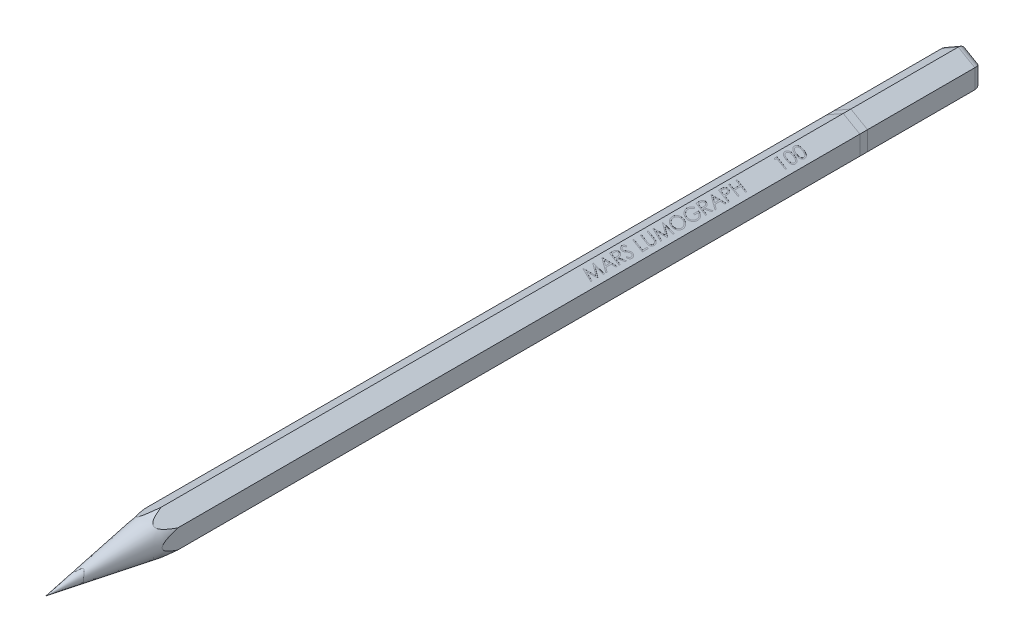
from build123d import *

# Parameters (mm, degrees)
SKETCH2_OUTSIDE_W  = 60.084
SKETCH2_OUTSIDE_H  = 60.084
CUT_EXTRUDE1_DEPTH = 241.104144071
FILLET3_R          = 2
CUT_EXTRUDE2_DEPTH = 0.02


with BuildPart() as part:
    # Sketch1 → Revolve1 (revolve)
    with BuildSketch(Plane(origin=(0, 0, 0), x_dir=(0, 0, -1), z_dir=(1, 0, 0)), mode=Mode.PRIVATE) as revolve1_sk:
        Polygon((0, 0), (240, 0), (240, 5), (30, 5), align=None)
    revolve(revolve1_sk.sketch.rotate(Axis((0, 0, 0), (0, 0, -1)), 270), axis=Axis((0, 0, 0), (0, 0, -1)))

    # Sketch2 outside → Cut-Extrude1 (cut, through all)
    with BuildSketch(Plane(origin=(0, 0, -240), x_dir=(-1, 0, 0), z_dir=(0, 0, -1))):
        Rectangle(SKETCH2_OUTSIDE_W, SKETCH2_OUTSIDE_H)
        Polygon((0, -5), (4.330127019, -2.5), (4.330127019, 2.5), (0, 5), (-4.330127019, 2.5), (-4.330127019, -2.5), align=None, mode=Mode.SUBTRACT)
    extrude(amount=-CUT_EXTRUDE1_DEPTH, mode=Mode.SUBTRACT)

    # Fillet3
    fillet3_edges = [part.edges().sort_by_distance(p)[0] for p in [
        (2.165063509, -3.75, -240),
        (4.330127019, 0, -240),
        (2.165063509, 3.75, -240),
        (-2.165063509, 3.75, -240),
        (-4.330127019, 0, -240),
        (-2.165063509, -3.75, -240),
    ]]
    fillet(fillet3_edges, radius=FILLET3_R)

    # Sketch9 → Cut-Extrude2 (cut)
    # profile 1 of 16: a face of its own
    with BuildSketch(Plane(origin=(2.165063509, 3.75, 0), x_dir=(0.8660254037844346, -0.5000000000000071, 0), z_dir=(0.500000000000007, 0.8660254037844345, 0))):
        Polygon((1.214386361, 138.929143212), (-1.696030305, 139.366988348), (-1.696030305, 139.439865368), (0.692003883, 140.701512336), (-1.696030305, 141.961410256), (-1.696030305, 142.034870292), (1.214386361, 142.47388146), (1.214386361, 142.173628138), (-0.875143553, 141.858216396), (1.214386361, 140.756315855), (1.214386361, 140.649040882), (-0.875143553, 139.544808276), (1.214386361, 139.230562567), align=None)
    # profile 2 of 16: a face of its own
    with BuildSketch(Plane(origin=(2.165063509, 3.75, 0), x_dir=(0.8660254037844346, -0.5000000000000071, 0), z_dir=(0.500000000000007, 0.8660254037844345, 0))):
        Polygon((-1.696030305, 144.376846204), (1.214386361, 145.832054537), (1.214386361, 145.503233423), (0.281560507, 145.036820496), (0.281560507, 143.655072199), (1.214386361, 143.176998948), (1.214386361, 142.847011802), (-1.696030305, 144.33953317), align=None)
        Polygon((-1.082697306, 144.35469159), (-0.016943767, 143.808405448), (-0.016943767, 144.888151375), align=None, mode=Mode.SUBTRACT)
    # profile 3 of 16: a face of its own
    with BuildSketch(Plane(origin=(2.165063509, 3.75, 0), x_dir=(0.8660254037844346, -0.5000000000000071, 0), z_dir=(0.500000000000007, 0.8660254037844345, 0))):
        with BuildLine():
            Line((-1.696030305, 146.317123981), (-1.696030305, 146.946781433))
            add(Edge.make_bspline(
                [(-1.696030305, 146.946781433), (-1.695901844, 146.988952695), (-1.695655565, 147.069801125), (-1.694261827, 147.185653181), (-1.690305739, 147.290770305), (-1.686880658, 147.38528483), (-1.680621428, 147.469205723), (-1.674780718, 147.542580076), (-1.666826998, 147.6052459), (-1.659655048, 147.643123862), (-1.656385207, 147.660393212)],
                knots=[0, 0, 0, 0, 1.414339765, 2.711494627, 3.88531881, 4.942159382, 5.882957806, 6.707302181, 7.410632199, 8, 8, 8, 8], degree=3))
            add(Edge.make_bspline(
                [(-1.656385207, 147.660393212), (-1.651140317, 147.683431605), (-1.640804111, 147.728833811), (-1.618718694, 147.794332332), (-1.593239695, 147.856761319), (-1.563556401, 147.916047869), (-1.528774726, 147.971532298), (-1.49041776, 148.024148704), (-1.447648913, 148.073237713), (-1.401028963, 148.118883534), (-1.350578562, 148.159895922), (-1.297410497, 148.196451202), (-1.241005781, 148.227111288), (-1.181548496, 148.251168857), (-1.119623086, 148.270822147), (-1.054839228, 148.28475711), (-0.987097984, 148.292931837), (-0.941046501, 148.294115044), (-0.917703733, 148.294714793)],
                knots=[0, 0, 0, 0, 1.06985947, 2.108392712, 3.127029127, 4.123234595, 5.107855884, 6.090506905, 7.070353336, 8.054108193, 9.042815066, 10.012321919, 10.973598003, 11.94482246, 12.913889438, 13.913784352, 14.942530328, 16, 16, 16, 16], degree=3))
            add(Edge.make_bspline(
                [(-0.917703733, 148.294714793), (-0.898060806, 148.29442911), (-0.859267882, 148.293864913), (-0.801969186, 148.287866294), (-0.746649136, 148.278006293), (-0.693166751, 148.26429931), (-0.641140171, 148.247961975), (-0.591453682, 148.225686398), (-0.543131198, 148.200969865), (-0.481379876, 148.162650396), (-0.410139212, 148.10536522), (-0.335094303, 148.023258318), (-0.2719311, 147.927494473), (-0.228796509, 147.837997746), (-0.200802775, 147.758908611), (-0.181275241, 147.693661981), (-0.165995795, 147.622605373), (-0.152475229, 147.546408149), (-0.142141193, 147.464678954), (-0.134640214, 147.377548908), (-0.129950121, 147.284981567), (-0.12924496, 147.221387678), (-0.12888287, 147.188733139)],
                knots=[0, 0, 0, 0, 0.765727938, 1.51224032, 2.243597852, 2.954892557, 3.664246923, 4.366767899, 5.075150103, 5.77963024, 7.197468406, 8.624290223, 10.099748923, 11.655498899, 12.484879315, 13.369704222, 14.309208053, 15.317126835, 16.386797013, 17.520226779, 18.72667245, 20, 20, 20, 20], degree=3))
            Line((-0.12888287, 147.188733139), (1.214386361, 148.332027828))
            Line((1.214386361, 148.332027828), (1.214386361, 147.952484308))
            Line((1.214386361, 147.952484308), (-0.12888287, 146.80918962))
            Line((-0.12888287, 146.80918962), (-0.12888287, 146.615628255))
            Line((-0.12888287, 146.615628255), (1.214386361, 146.615628255))
            Line((1.214386361, 146.615628255), (1.214386361, 146.317123981))
            Line((1.214386361, 146.317123981), (-1.696030305, 146.317123981))
        make_face()
        with BuildLine():
            Line((-1.397526032, 146.615628255), (-0.427387143, 146.615628255))
            Line((-0.427387143, 146.615628255), (-0.42330603, 147.178821865))
            add(Edge.make_bspline(
                [(-0.42330603, 147.178821865), (-0.423294438, 147.205256226), (-0.423272012, 147.25639407), (-0.426581587, 147.330243589), (-0.43039036, 147.398891445), (-0.436122229, 147.462103042), (-0.44363141, 147.52007707), (-0.452867249, 147.572627732), (-0.463779139, 147.619987588), (-0.480610385, 147.675046333), (-0.506155164, 147.737239236), (-0.545886943, 147.803453163), (-0.593874413, 147.86134119), (-0.649784955, 147.909213402), (-0.711076352, 147.948314104), (-0.777072105, 147.97548024), (-0.846377584, 147.993699134), (-0.89407124, 147.995364807), (-0.918286749, 147.99621052)],
                knots=[0, 0, 0, 0, 1.174572278, 2.272235562, 3.284492715, 4.22980572, 5.092142038, 5.881598737, 6.600128721, 7.25032431, 8.438816014, 9.577796666, 10.669190652, 11.765187898, 12.836266602, 13.885251582, 14.926278371, 16, 16, 16, 16], degree=3))
            add(Edge.make_bspline(
                [(-0.918286749, 147.99621052), (-0.941694854, 147.99500663), (-0.988111329, 147.992619408), (-1.056133998, 147.975967322), (-1.120512803, 147.947248794), (-1.180581044, 147.90838557), (-1.235021185, 147.860604682), (-1.281253316, 147.804674663), (-1.319501986, 147.742081455), (-1.344794432, 147.684363971), (-1.359921905, 147.632351409), (-1.370481145, 147.587265354), (-1.378241388, 147.535944936), (-1.385221464, 147.478786264), (-1.391034287, 147.415606999), (-1.395024069, 147.346386302), (-1.397350255, 147.271343596), (-1.397466009, 147.21924606), (-1.397526032, 147.192231236)],
                knots=[0, 0, 0, 0, 1.061764534, 2.10539748, 3.155565728, 4.24640529, 5.339665462, 6.429114306, 7.525499099, 8.658981933, 9.275511958, 9.981350656, 10.758339786, 11.628906331, 12.594047291, 13.636338423, 14.774339325, 16, 16, 16, 16], degree=3))
            Line((-1.397526032, 147.192231236), (-1.397526032, 146.615628255))
        make_face(mode=Mode.SUBTRACT)
    # profile 4 of 16: a face of its own
    with BuildSketch(Plane(origin=(2.165063509, 3.75, 0), x_dir=(0.8660254037844346, -0.5000000000000071, 0), z_dir=(0.500000000000007, 0.8660254037844345, 0))):
        with BuildLine():
            Line((0.6529418, 148.667845135), (0.505438712, 148.93428352))
            add(Edge.make_bspline(
                [(0.505438712, 148.93428352), (0.543822105, 148.958054173), (0.617658503, 149.003780704), (0.716320644, 149.081173932), (0.800536571, 149.160430892), (0.870029253, 149.242506906), (0.92367384, 149.328140466), (0.962256279, 149.416653767), (0.986192829, 149.50827017), (0.989067632, 149.570602925), (0.990508156, 149.601837022)],
                knots=[0, 0, 0, 0, 1.253021552, 2.410380904, 3.475470111, 4.460185, 5.388689421, 6.270994921, 7.133619014, 8, 8, 8, 8], degree=3))
            add(Edge.make_bspline(
                [(0.990508156, 149.601837022), (0.989775885, 149.628511937), (0.988324001, 149.68140063), (0.975124643, 149.759310909), (0.953290003, 149.834485222), (0.923817242, 149.906264772), (0.887485456, 149.972895862), (0.845179126, 150.032628121), (0.795397857, 150.08250806), (0.741189983, 150.123960324), (0.683351174, 150.156909139), (0.623012942, 150.180213569), (0.560764399, 150.195092367), (0.518541938, 150.196812957), (0.497276485, 150.197679537)],
                knots=[0, 0, 0, 0, 1.117701984, 2.216081951, 3.301695279, 4.394136047, 5.462520971, 6.477892584, 7.451577853, 8.404902923, 9.331639019, 10.231922614, 11.109503192, 12, 12, 12, 12], degree=3))
            add(Edge.make_bspline(
                [(0.497276485, 150.197679537), (0.473035941, 150.196265572), (0.423912065, 150.193400147), (0.35111816, 150.171613629), (0.278929925, 150.136927067), (0.234629034, 150.104399444), (0.211598567, 150.087489483)],
                knots=[0, 0, 0, 0, 0.931938035, 1.888588254, 2.90235174, 4, 4, 4, 4], degree=3))
            add(Edge.make_bspline(
                [(0.211598567, 150.087489483), (0.194903713, 150.073697157), (0.159764514, 150.044667178), (0.107963932, 149.994620187), (0.053734175, 149.936789213), (-0.002527151, 149.870605461), (-0.062009801, 149.797271444), (-0.123847773, 149.716012161), (-0.188008725, 149.626780479), (-0.230492212, 149.563860422), (-0.252482295, 149.531292067)],
                knots=[0, 0, 0, 0, 0.714777265, 1.504457584, 2.376024072, 3.331596319, 4.371791934, 5.493442797, 6.702568795, 8, 8, 8, 8], degree=3))
            add(Edge.make_bspline(
                [(-0.252482295, 149.531292067), (-0.274271987, 149.498913135), (-0.315903318, 149.437050029), (-0.378066345, 149.350501988), (-0.434183002, 149.272674221), (-0.486453996, 149.204921053), (-0.533034146, 149.146217449), (-0.575257309, 149.097233165), (-0.612776805, 149.058020463), (-0.63734513, 149.036182273), (-0.648350267, 149.026400073)],
                knots=[0, 0, 0, 0, 1.456563732, 2.782907058, 3.976925193, 5.037437426, 5.976523114, 6.773507667, 7.450604967, 8, 8, 8, 8], degree=3))
            add(Edge.make_bspline(
                [(-0.648350267, 149.026400073), (-0.665450136, 149.012726312), (-0.698974492, 148.985918853), (-0.751812937, 148.950840166), (-0.8054099, 148.920710373), (-0.860724359, 148.897011908), (-0.916653934, 148.877333435), (-0.97411622, 148.863921313), (-1.032551473, 148.856396304), (-1.071793911, 148.855072922), (-1.091442548, 148.854410306)],
                knots=[0, 0, 0, 0, 1.081965651, 2.121197695, 3.131834961, 4.117128275, 5.092440341, 6.059578725, 7.028433586, 8, 8, 8, 8], degree=3))
            add(Edge.make_bspline(
                [(-1.091442548, 148.854410306), (-1.122242101, 148.855662153), (-1.183247989, 148.858141736), (-1.272444894, 148.877360854), (-1.357399158, 148.908604818), (-1.437471141, 148.951776249), (-1.511144579, 149.006954171), (-1.577224538, 149.072520545), (-1.635045214, 149.148246514), (-1.683486071, 149.233061676), (-1.72237699, 149.324872571), (-1.750528721, 149.421494814), (-1.767123105, 149.522170211), (-1.769467496, 149.590504334), (-1.770656374, 149.625157669)],
                knots=[0, 0, 0, 0, 0.967796381, 1.916952393, 2.854571153, 3.806025677, 4.766599812, 5.738784442, 6.723845998, 7.753098465, 8.801775384, 9.851804426, 10.910615437, 12, 12, 12, 12], degree=3))
            add(Edge.make_bspline(
                [(-1.770656374, 149.625157669), (-1.769650858, 149.661970994), (-1.767653121, 149.735110893), (-1.748153848, 149.842479028), (-1.717721772, 149.946383841), (-1.681990642, 150.029874393), (-1.646751243, 150.095684854), (-1.61413621, 150.145466879), (-1.576651869, 150.196007048), (-1.534953227, 150.248011326), (-1.487350424, 150.299897292), (-1.434615175, 150.352377442), (-1.377112899, 150.405924071), (-1.336243779, 150.440942847), (-1.315320753, 150.458870776)],
                knots=[0, 0, 0, 0, 1.343581969, 2.669398873, 3.972209689, 5.29212177, 5.978229007, 6.696944897, 7.463666474, 8.276335723, 9.130634109, 10.034185422, 10.993597435, 12, 12, 12, 12], degree=3))
            Line((-1.315320753, 150.458870776), (-1.136334793, 150.203509699))
            add(Edge.make_bspline(
                [(-1.136334793, 150.203509699), (-1.152725097, 150.188422589), (-1.184484751, 150.159188146), (-1.229428703, 150.115664476), (-1.269637094, 150.073450647), (-1.306208206, 150.033499088), (-1.337257368, 149.994258065), (-1.365334832, 149.95769303), (-1.387742397, 149.922065233), (-1.41298146, 149.8778452), (-1.436696525, 149.821487543), (-1.457335704, 149.751506271), (-1.469840079, 149.678464532), (-1.471376548, 149.628703563), (-1.4721521, 149.603586071)],
                knots=[0, 0, 0, 0, 1.1264946, 2.182819734, 3.162837221, 4.074442579, 4.920099024, 5.692522356, 6.404030606, 7.046419284, 8.265828538, 9.484802126, 10.730421381, 12, 12, 12, 12], degree=3))
            add(Edge.make_bspline(
                [(-1.4721521, 149.603586071), (-1.471168025, 149.571769897), (-1.469273733, 149.510525459), (-1.447887265, 149.423780255), (-1.415544665, 149.345272209), (-1.375772521, 149.288849429), (-1.339770077, 149.248887053), (-1.309894116, 149.224027844), (-1.280021251, 149.201198621), (-1.247292065, 149.183960314), (-1.213733592, 149.169485826), (-1.178025343, 149.160722238), (-1.141479466, 149.153528798), (-1.116356189, 149.153120496), (-1.103685888, 149.15291458)],
                knots=[0, 0, 0, 0, 1.759665536, 3.387262382, 4.921779605, 6.439534783, 7.186548161, 7.89686244, 8.590568063, 9.265368992, 9.94145812, 10.610301379, 11.29914001, 12, 12, 12, 12], degree=3))
            add(Edge.make_bspline(
                [(-1.103685888, 149.15291458), (-1.088106247, 149.153531628), (-1.056741003, 149.154773881), (-1.010348907, 149.163094393), (-0.964574633, 149.176756835), (-0.919089595, 149.196301779), (-0.872607977, 149.223065304), (-0.82559445, 149.259280532), (-0.776450813, 149.303911395), (-0.744501587, 149.337878271), (-0.727640465, 149.355804203)],
                knots=[0, 0, 0, 0, 0.847287453, 1.705776054, 2.555236634, 3.440761766, 4.392632249, 5.464479773, 6.661885649, 8, 8, 8, 8], degree=3))
            add(Edge.make_bspline(
                [(-0.727640465, 149.355804203), (-0.721947176, 149.362560047), (-0.708387661, 149.378650216), (-0.686483569, 149.408025668), (-0.658818038, 149.446401175), (-0.625487607, 149.493697059), (-0.586078446, 149.549818077), (-0.542096123, 149.615280379), (-0.491701389, 149.68934447), (-0.456500919, 149.741930174), (-0.437881434, 149.769745676)],
                knots=[0, 0, 0, 0, 0.419436643, 0.998958289, 1.739145775, 2.665983594, 3.746274523, 4.995278854, 6.410635948, 8, 8, 8, 8], degree=3))
            add(Edge.make_bspline(
                [(-0.437881434, 149.769745676), (-0.414949956, 149.803309132), (-0.370681229, 149.868102664), (-0.303248735, 149.959944092), (-0.238230029, 150.043990442), (-0.174868638, 150.119680313), (-0.113591828, 150.187180683), (-0.053936662, 150.246222909), (0.003300372, 150.297685313), (0.059548469, 150.340987829), (0.114967169, 150.37734619), (0.169817255, 150.408990648), (0.224865939, 150.436067028), (0.279996134, 150.458143089), (0.335294194, 150.475541), (0.390664434, 150.486616625), (0.445909988, 150.495066942), (0.482862776, 150.495811274), (0.501357599, 150.496183811)],
                knots=[0, 0, 0, 0, 1.577923704, 3.046147902, 4.422448976, 5.702345117, 6.87718224, 7.960131477, 8.959437433, 9.863312197, 10.712847472, 11.530705048, 12.320234814, 13.09215854, 13.834309341, 14.566733176, 15.282651781, 16, 16, 16, 16], degree=3))
            add(Edge.make_bspline(
                [(0.501357599, 150.496183811), (0.527451985, 150.495431011), (0.579155075, 150.493939425), (0.655121653, 150.481078695), (0.728857006, 150.461551625), (0.799423535, 150.432534393), (0.867673689, 150.396129624), (0.933176954, 150.351612039), (0.995789845, 150.298579983), (1.05499459, 150.238609447), (1.109825517, 150.173148416), (1.157368001, 150.102987672), (1.199047806, 150.029933269), (1.231224776, 149.952517577), (1.257283912, 149.872038118), (1.275756271, 149.788110398), (1.28724794, 149.700492656), (1.288416751, 149.64093534), (1.28901243, 149.610582265)],
                knots=[0, 0, 0, 0, 0.951762989, 1.885811256, 2.804653954, 3.730614602, 4.663558012, 5.623610515, 6.615342964, 7.653570791, 8.696150781, 9.727059776, 10.743247239, 11.760300754, 12.780934367, 13.827247545, 14.892668041, 16, 16, 16, 16], degree=3))
            add(Edge.make_bspline(
                [(1.28901243, 149.610582265), (1.288601752, 149.58704548), (1.287792107, 149.540643086), (1.280223572, 149.471958468), (1.269715284, 149.404773944), (1.252940489, 149.339477156), (1.232584722, 149.275513617), (1.207682638, 149.213232115), (1.177503281, 149.152816812), (1.143237996, 149.093725575), (1.103063389, 149.036034461), (1.057134925, 148.979650966), (1.004837732, 148.924790992), (0.946721967, 148.870738549), (0.882043983, 148.818089955), (0.811545504, 148.7661364), (0.734668954, 148.715857534), (0.680675157, 148.6841377), (0.6529418, 148.667845135)],
                knots=[0, 0, 0, 0, 0.941548449, 1.856247686, 2.762743773, 3.660591361, 4.550929977, 5.447766513, 6.3416307, 7.251323843, 8.178990734, 9.151911111, 10.158653287, 11.209719236, 12.326003544, 13.494181283, 14.712912074, 16, 16, 16, 16], degree=3))
        make_face()
    # profile 5 of 16: a face of its own
    with BuildSketch(Plane(origin=(2.165063509, 3.75, 0), x_dir=(0.8660254037844346, -0.5000000000000071, 0), z_dir=(0.500000000000007, 0.8660254037844345, 0))):
        Polygon((-1.696030305, 152.36183552), (-1.696030305, 152.660339793), (0.915882088, 152.660339793), (0.915882088, 153.891669922), (1.214386361, 153.891669922), (1.214386361, 152.36183552), align=None)
    # profile 6 of 16: a face of its own
    with BuildSketch(Plane(origin=(2.165063509, 3.75, 0), x_dir=(0.8660254037844346, -0.5000000000000071, 0), z_dir=(0.500000000000007, 0.8660254037844345, 0))):
        with BuildLine():
            Line((-1.696030305, 154.376739366), (-1.696030305, 154.67524364))
            Line((-1.696030305, 154.67524364), (0.047771027, 154.67524364))
            add(Edge.make_bspline(
                [(0.047771027, 154.67524364), (0.072452171, 154.675196956), (0.119288897, 154.675108366), (0.185950127, 154.675700112), (0.245230117, 154.676763217), (0.297308347, 154.678604645), (0.3419986, 154.680449346), (0.379569242, 154.681711108), (0.409681393, 154.684717664), (0.427319311, 154.687062868), (0.434893756, 154.688069995)],
                knots=[0, 0, 0, 0, 1.528365921, 2.900337718, 4.128080151, 5.199748041, 6.127098136, 6.898143988, 7.526817833, 8, 8, 8, 8], degree=3))
            add(Edge.make_bspline(
                [(0.434893756, 154.688069995), (0.462447858, 154.692647526), (0.515740884, 154.701501035), (0.591186002, 154.725441016), (0.66005453, 154.755865477), (0.721953664, 154.796035434), (0.778627246, 154.845074447), (0.828749735, 154.906529244), (0.87483003, 154.978449269), (0.914665498, 155.060436422), (0.94786602, 155.147865431), (0.97269132, 155.237566053), (0.987884648, 155.327700616), (0.989637058, 155.388021565), (0.990508156, 155.418006226)],
                knots=[0, 0, 0, 0, 0.997438106, 1.929168165, 2.821574428, 3.681109549, 4.557578704, 5.489852597, 6.505514637, 7.605462628, 8.742292506, 9.844629666, 10.928596933, 12, 12, 12, 12], degree=3))
            add(Edge.make_bspline(
                [(0.990508156, 155.418006226), (0.989629294, 155.443887967), (0.987883468, 155.495301079), (0.976744478, 155.57159938), (0.957280902, 155.645968129), (0.930456796, 155.717920882), (0.897548914, 155.786387275), (0.858647106, 155.849992423), (0.812404398, 155.906595172), (0.761835733, 155.958453288), (0.704761816, 156.003585861), (0.641905788, 156.04216823), (0.573322529, 156.074678024), (0.524496108, 156.09038169), (0.49960855, 156.098386084)],
                knots=[0, 0, 0, 0, 1.032668172, 2.051356764, 3.068775704, 4.094258079, 5.110346615, 6.095797679, 7.060906371, 8.020392294, 8.980661126, 9.955439121, 10.957856679, 12, 12, 12, 12], degree=3))
            add(Edge.make_bspline(
                [(0.49960855, 156.098386084), (0.489344545, 156.101083633), (0.466495689, 156.107088687), (0.42778482, 156.112817812), (0.382174256, 156.11896724), (0.329195271, 156.122529605), (0.269149582, 156.126042141), (0.201717836, 156.129213566), (0.127062072, 156.129925658), (0.074977914, 156.13027138), (0.047771027, 156.130451973)],
                knots=[0, 0, 0, 0, 0.560648202, 1.248067364, 2.066168439, 2.993596529, 4.053584458, 5.246443539, 6.561641311, 8, 8, 8, 8], degree=3))
            Line((0.047771027, 156.130451973), (-1.696030305, 156.130451973))
            Line((-1.696030305, 156.130451973), (-1.696030305, 156.428956246))
            Line((-1.696030305, 156.428956246), (0.061763415, 156.428956246))
            add(Edge.make_bspline(
                [(0.061763415, 156.428956246), (0.093446172, 156.428801289), (0.155285143, 156.428498841), (0.245875505, 156.424138251), (0.331829097, 156.417947924), (0.413103061, 156.409148263), (0.489628309, 156.398385157), (0.561347282, 156.384216115), (0.628622249, 156.368206082), (0.691680798, 156.348667384), (0.751907388, 156.326217278), (0.809117092, 156.297670125), (0.864995725, 156.265324221), (0.917889817, 156.226305249), (0.96927428, 156.183056228), (1.019313295, 156.135247315), (1.066108237, 156.081203496), (1.11156481, 156.023368346), (1.153417531, 155.961531369), (1.189927901, 155.895872444), (1.219947326, 155.826511469), (1.246083187, 155.754508565), (1.264879383, 155.678796394), (1.279140506, 155.600355819), (1.287239802, 155.518454908), (1.2884142, 155.462721082), (1.28901243, 155.434330679)],
                knots=[0, 0, 0, 0, 1.265505223, 2.470035654, 3.622165977, 4.707522937, 5.735149889, 6.708037379, 7.626892872, 8.496169055, 9.343928901, 10.191084257, 11.047191739, 11.919893076, 12.8124982, 13.729383871, 14.680976104, 15.665532687, 16.666751363, 17.660568831, 18.661637009, 19.683087379, 20.71679571, 21.773624885, 22.865900834, 24, 24, 24, 24], degree=3))
            add(Edge.make_bspline(
                [(1.28901243, 155.434330679), (1.288355561, 155.40361393), (1.287064777, 155.343253851), (1.279777544, 155.254366285), (1.265913696, 155.169005256), (1.248363168, 155.086592497), (1.224258545, 155.007725815), (1.194966446, 154.93243892), (1.161200106, 154.86005727), (1.121593883, 154.791875491), (1.078224673, 154.727727046), (1.030645593, 154.669376821), (0.980440766, 154.615659077), (0.926179769, 154.568095913), (0.868751778, 154.525422188), (0.807228568, 154.489674015), (0.742886632, 154.458141028), (0.697812907, 154.442006509), (0.675096414, 154.43387495)],
                knots=[0, 0, 0, 0, 1.173589405, 2.306166897, 3.403447662, 4.475241948, 5.52269301, 6.549819791, 7.559410689, 8.570501784, 9.558906624, 10.514306147, 11.443857144, 12.364351341, 13.267161553, 14.17244092, 15.078937143, 16, 16, 16, 16], degree=3))
            add(Edge.make_bspline(
                [(0.675096414, 154.43387495), (0.659611035, 154.429166083), (0.626065262, 154.418965328), (0.570407845, 154.407911445), (0.506445566, 154.39789883), (0.433799082, 154.390854379), (0.352962698, 154.384324928), (0.263536691, 154.379621288), (0.165548671, 154.377679686), (0.09732777, 154.377061588), (0.061763415, 154.376739366)],
                knots=[0, 0, 0, 0, 0.628224746, 1.360915039, 2.200951013, 3.141919593, 4.194245416, 5.350528196, 6.618799321, 8, 8, 8, 8], degree=3))
            Line((0.061763415, 154.376739366), (-1.696030305, 154.376739366))
        make_face()
    # profile 7 of 16: a face of its own
    with BuildSketch(Plane(origin=(2.165063509, 3.75, 0), x_dir=(0.8660254037844346, -0.5000000000000071, 0), z_dir=(0.500000000000007, 0.8660254037844345, 0))):
        Polygon((1.214386361, 157.137903896), (-1.696030305, 157.575749032), (-1.696030305, 157.648626051), (0.692003883, 158.91027302), (-1.696030305, 160.17017094), (-1.696030305, 160.243630976), (1.214386361, 160.682642144), (1.214386361, 160.382388822), (-0.875143553, 160.06697708), (1.214386361, 158.965076539), (1.214386361, 158.857801566), (-0.875143553, 157.75356896), (1.214386361, 157.43932325), align=None)
    # profile 8 of 16: a face of its own
    with BuildSketch(Plane(origin=(2.165063509, 3.75, 0), x_dir=(0.8660254037844346, -0.5000000000000071, 0), z_dir=(0.500000000000007, 0.8660254037844345, 0))):
        with BuildLine():
            add(Edge.make_bspline(
                [(-1.770656374, 162.789079527), (-1.769310983, 162.84705197), (-1.766670278, 162.960839145), (-1.745948617, 163.127712728), (-1.711520971, 163.287357903), (-1.663243801, 163.439979705), (-1.60048153, 163.585155995), (-1.524315354, 163.723140951), (-1.433907287, 163.853485208), (-1.331411338, 163.975820625), (-1.218651777, 164.087003008), (-1.098163568, 164.184644174), (-0.970726416, 164.266351017), (-0.837915572, 164.335196519), (-0.697656439, 164.386704785), (-0.551448219, 164.424420838), (-0.398737129, 164.446870775), (-0.294727559, 164.449782278), (-0.241988004, 164.451258597)],
                knots=[0, 0, 0, 0, 1.104282476, 2.167463989, 3.198003979, 4.212082699, 5.212160217, 6.206546214, 7.209990361, 8.229731356, 9.242991831, 10.222563663, 11.178742637, 12.122626689, 13.066924602, 14.018850102, 14.995429327, 16, 16, 16, 16], degree=3))
            add(Edge.make_bspline(
                [(-0.241988004, 164.451258597), (-0.189634751, 164.449788144), (-0.086394202, 164.446888413), (0.065319102, 164.424330097), (0.210814566, 164.386784276), (0.350387348, 164.334880132), (0.483620981, 164.267188796), (0.610560118, 164.184353514), (0.731626499, 164.087114713), (0.845138541, 163.976305541), (0.948325927, 163.854810007), (1.040435213, 163.726336943), (1.116686893, 163.590091607), (1.180517002, 163.447939655), (1.228448985, 163.298556358), (1.26369952, 163.143138912), (1.285130837, 162.981101487), (1.28770508, 162.870766679), (1.28901243, 162.814732238)],
                knots=[0, 0, 0, 0, 1.00701373, 1.985829764, 2.943527526, 3.893640243, 4.845142567, 5.812789005, 6.804941216, 7.828254859, 8.860031856, 9.868474634, 10.864705163, 11.859025184, 12.861753493, 13.877717403, 14.922181321, 16, 16, 16, 16], degree=3))
            add(Edge.make_bspline(
                [(1.28901243, 162.814732238), (1.287731717, 162.758108934), (1.285209614, 162.6466009), (1.263371511, 162.482769787), (1.229569774, 162.325487728), (1.180737814, 162.175158533), (1.118084625, 162.03162729), (1.041455437, 161.894646742), (0.950529511, 161.764835978), (0.847258113, 161.643269999), (0.734765667, 161.532102323), (0.614768578, 161.43438067), (0.488229901, 161.352585231), (0.356289957, 161.284916164), (0.218557408, 161.232016471), (0.074831141, 161.194761845), (-0.074715437, 161.172055108), (-0.176416023, 161.169173206), (-0.227995617, 161.167711588)],
                knots=[0, 0, 0, 0, 1.090007837, 2.146547848, 3.177224824, 4.18441606, 5.184972819, 6.188625542, 7.201944888, 8.232227685, 9.256408654, 10.243626549, 11.2069681, 12.152656664, 13.094449289, 14.042142631, 15.007031417, 16, 16, 16, 16], degree=3))
            add(Edge.make_bspline(
                [(-0.227995617, 161.167711588), (-0.262610378, 161.168426665), (-0.331397293, 161.169847675), (-0.433687634, 161.179944491), (-0.534229097, 161.196789191), (-0.632732165, 161.220838891), (-0.729432944, 161.25116295), (-0.824095945, 161.288634537), (-0.916745772, 161.33299687), (-1.006988903, 161.383813814), (-1.09415415, 161.439840083), (-1.176607336, 161.501992882), (-1.254167337, 161.56896158), (-1.326644346, 161.641008668), (-1.394418965, 161.717535675), (-1.457610785, 161.79886391), (-1.516110003, 161.885189986), (-1.568656742, 161.976675688), (-1.616581836, 162.071009562), (-1.657170415, 162.168278838), (-1.69243944, 162.266831564), (-1.721075444, 162.367515228), (-1.74327651, 162.470152878), (-1.758685588, 162.574759153), (-1.769347523, 162.681195397), (-1.770217515, 162.75290592), (-1.770656374, 162.789079527)],
                knots=[0, 0, 0, 0, 1.000860702, 1.988923732, 2.969140983, 3.946405888, 4.918600368, 5.897447419, 6.887793071, 7.886663957, 8.890501988, 9.881803818, 10.869866848, 11.851371953, 12.834677219, 13.823874237, 14.827633617, 15.847405218, 16.872782081, 17.885187697, 18.892981817, 19.898014594, 20.909858577, 21.927149733, 22.954372848, 24, 24, 24, 24], degree=3))
        make_face()
        with BuildLine():
            add(Edge.make_bspline(
                [(-1.4721521, 162.803071915), (-1.471816396, 162.773898579), (-1.471148104, 162.715822664), (-1.462303417, 162.629441223), (-1.449792727, 162.544115075), (-1.431618301, 162.459993917), (-1.408129082, 162.376899528), (-1.379739053, 162.294843063), (-1.345670707, 162.214118035), (-1.306773639, 162.135053688), (-1.263300654, 162.058907994), (-1.216859911, 161.986014851), (-1.165561124, 161.918341645), (-1.111660775, 161.854133528), (-1.053802477, 161.794280898), (-0.991722775, 161.73975318), (-0.926797123, 161.688543481), (-0.858288176, 161.642045557), (-0.786615204, 161.600870388), (-0.713140981, 161.564515682), (-0.637414179, 161.5338259), (-0.559452044, 161.509764326), (-0.479656727, 161.490268085), (-0.398057161, 161.476264718), (-0.314258747, 161.46799925), (-0.257747698, 161.466814942), (-0.229161649, 161.466215862)],
                knots=[0, 0, 0, 0, 1.034159295, 2.058720617, 3.076304141, 4.091480895, 5.108223865, 6.136995319, 7.168671414, 8.213545778, 9.259873818, 10.27689705, 11.276229114, 12.268980279, 13.248630966, 14.225052039, 15.197036253, 16.179567595, 17.158369417, 18.126190938, 19.084766134, 20.052587655, 21.017090711, 21.996038104, 22.986298165, 24, 24, 24, 24], degree=3))
            add(Edge.make_bspline(
                [(-0.229161649, 161.466215862), (-0.187126298, 161.46752104), (-0.104410557, 161.470089324), (0.017141072, 161.488223467), (0.133356676, 161.519793527), (0.245312732, 161.561784222), (0.351284459, 161.618282372), (0.453033974, 161.685322022), (0.548556017, 161.766175707), (0.63911201, 161.856919364), (0.720904954, 161.956976819), (0.793110302, 162.062809268), (0.854189192, 162.173899561), (0.904515478, 162.289929569), (0.943061913, 162.411308495), (0.970195233, 162.537432557), (0.987945205, 162.668472948), (0.989644824, 162.75773216), (0.990508156, 162.803071915)],
                knots=[0, 0, 0, 0, 1.001946105, 1.971595667, 2.92115045, 3.868408408, 4.815394452, 5.777756986, 6.767722144, 7.793042867, 8.8298947, 9.843690755, 10.843063199, 11.8473627, 12.853882169, 13.873420005, 14.919790866, 16, 16, 16, 16], degree=3))
            add(Edge.make_bspline(
                [(0.990508156, 162.803071915), (0.99011038, 162.833599231), (0.989321167, 162.89416729), (0.98146763, 162.984112486), (0.96877544, 163.072330541), (0.950479634, 163.158688566), (0.927891717, 163.243473153), (0.899843904, 163.32643866), (0.866397025, 163.407471899), (0.828786329, 163.48668389), (0.786254634, 163.56265452), (0.740370535, 163.635055651), (0.690541125, 163.703055182), (0.637002645, 163.766778607), (0.578975161, 163.825659332), (0.517632937, 163.880556806), (0.452904196, 163.931672482), (0.384106813, 163.977200752), (0.313214575, 164.01900278), (0.239497904, 164.054347285), (0.163999762, 164.084913518), (0.086497304, 164.110015307), (0.006985136, 164.12934103), (-0.074504775, 164.142576037), (-0.157857469, 164.150989603), (-0.214177557, 164.152162841), (-0.242571021, 164.152754323)],
                knots=[0, 0, 0, 0, 1.078194132, 2.139203032, 3.186800705, 4.224907435, 5.255747181, 6.284802239, 7.316190498, 8.351023153, 9.380581898, 10.38996055, 11.377244714, 12.356475934, 13.327417548, 14.294930884, 15.263150318, 16.238040096, 17.207111033, 18.168172579, 19.123034932, 20.082648669, 21.043415922, 22.010661292, 22.997085785, 24, 24, 24, 24], degree=3))
            add(Edge.make_bspline(
                [(-0.242571021, 164.152754323), (-0.270770178, 164.152162544), (-0.326702469, 164.150988765), (-0.409475057, 164.14258051), (-0.490377958, 164.129326211), (-0.56915025, 164.110110841), (-0.645650651, 164.084892452), (-0.720006724, 164.054369405), (-0.79263279, 164.018812587), (-0.862788128, 163.977403072), (-0.93051513, 163.931440065), (-0.994826259, 163.880588285), (-1.055356026, 163.825017588), (-1.113057253, 163.76541645), (-1.16617408, 163.700606921), (-1.216891145, 163.631919203), (-1.263925228, 163.558752497), (-1.306780819, 163.481265301), (-1.34573012, 163.401366773), (-1.379588357, 163.319590426), (-1.408368712, 163.236499324), (-1.431497146, 163.152131204), (-1.449881407, 163.066508281), (-1.46224477, 162.979798756), (-1.471176917, 162.891875836), (-1.471825331, 162.832828784), (-1.4721521, 162.803071915)],
                knots=[0, 0, 0, 0, 0.999541625, 1.982564721, 2.946401585, 3.90384022, 4.853713985, 5.799155324, 6.751200176, 7.717717067, 8.684602188, 9.650799834, 10.62121285, 11.595701251, 12.588931297, 13.58930355, 14.62125016, 15.669804609, 16.726654926, 17.770650371, 18.805536351, 19.841797291, 20.870057872, 21.90769195, 22.945577573, 24, 24, 24, 24], degree=3))
        make_face(mode=Mode.SUBTRACT)
    # profile 9 of 16: a face of its own
    with BuildSketch(Plane(origin=(2.165063509, 3.75, 0), x_dir=(0.8660254037844346, -0.5000000000000071, 0), z_dir=(0.500000000000007, 0.8660254037844345, 0))):
        with BuildLine():
            Line((-1.199300538, 168.070622913), (-0.987082656, 167.827505175))
            add(Edge.make_bspline(
                [(-0.987082656, 167.827505175), (-1.025220392, 167.784055048), (-1.100727687, 167.698029976), (-1.198639396, 167.558410203), (-1.282641403, 167.412771433), (-1.350870764, 167.261779694), (-1.404344776, 167.109081598), (-1.443091096, 166.957369644), (-1.467795684, 166.807455441), (-1.470710908, 166.707816202), (-1.4721521, 166.658557776)],
                knots=[0, 0, 0, 0, 1.07155981, 2.121536031, 3.15644657, 4.185529133, 5.18975329, 6.153069978, 7.086937368, 8, 8, 8, 8], degree=3))
            add(Edge.make_bspline(
                [(-1.4721521, 166.658557776), (-1.471823972, 166.628218588), (-1.471172788, 166.568009165), (-1.462258702, 166.478335252), (-1.449805834, 166.38970589), (-1.431599179, 166.30210395), (-1.40828216, 166.215650733), (-1.379480732, 166.130256266), (-1.345892164, 166.04584586), (-1.306772938, 165.963491574), (-1.26393502, 165.883674034), (-1.216858827, 165.80808329), (-1.166002777, 165.737040951), (-1.110874422, 165.671147336), (-1.052669056, 165.609219744), (-0.99090564, 165.551904287), (-0.925014532, 165.499779468), (-0.856074464, 165.452244031), (-0.784591458, 165.409758822), (-0.711681914, 165.373071756), (-0.63779418, 165.341695216), (-0.562753547, 165.317037499), (-0.486886142, 165.296870946), (-0.410182598, 165.282132502), (-0.332144306, 165.27399481), (-0.279901606, 165.272763908), (-0.253648328, 165.272145349)],
                knots=[0, 0, 0, 0, 1.066484393, 2.116484127, 3.166105695, 4.21289782, 5.2606488, 6.313136584, 7.380430868, 8.453486095, 9.517624901, 10.564417025, 11.58291804, 12.587451303, 13.583369219, 14.569957708, 15.547629446, 16.535282536, 17.512787055, 18.469427501, 19.403614325, 20.332913694, 21.244631816, 22.162782071, 23.076751478, 24, 24, 24, 24], degree=3))
            add(Edge.make_bspline(
                [(-0.253648328, 165.272145349), (-0.22679785, 165.272637164), (-0.173127889, 165.273620225), (-0.093331657, 165.283705211), (-0.014251351, 165.297773761), (0.06339421, 165.319164444), (0.140285455, 165.345935636), (0.215781243, 165.379505712), (0.290892535, 165.417840656), (0.363939185, 165.462803897), (0.434876261, 165.512766155), (0.502604269, 165.567335962), (0.56579244, 165.627322027), (0.625128796, 165.691591098), (0.681510729, 165.759615189), (0.73268627, 165.833117287), (0.780686301, 165.910612907), (0.82407985, 165.992519913), (0.863010189, 166.07765759), (0.897745019, 166.165017277), (0.926120499, 166.254944411), (0.949265994, 166.346698031), (0.968460726, 166.440173071), (0.980625883, 166.53588475), (0.989549509, 166.633513925), (0.990186437, 166.699347577), (0.990508156, 166.732600828)],
                knots=[0, 0, 0, 0, 0.90710003, 1.813152929, 2.715029073, 3.620128984, 4.532162809, 5.464596528, 6.410606246, 7.380600736, 8.361103484, 9.341870245, 10.317696973, 11.303116313, 12.297276506, 13.301455856, 14.32782077, 15.376909929, 16.432130268, 17.490942996, 18.552523335, 19.616783, 20.688617851, 21.775563789, 22.876414522, 24, 24, 24, 24], degree=3))
            add(Edge.make_bspline(
                [(0.990508156, 166.732600828), (0.989706992, 166.772469967), (0.988128537, 166.851020265), (0.976197101, 166.966352241), (0.957286743, 167.077156431), (0.9296386, 167.182938219), (0.894826435, 167.284319449), (0.851415079, 167.380756194), (0.800524236, 167.472603862), (0.742658638, 167.55923174), (0.677958079, 167.638567948), (0.609248324, 167.711141057), (0.534865345, 167.774007225), (0.456307182, 167.82905199), (0.372498746, 167.874273507), (0.284477602, 167.912083808), (0.191629784, 167.940897279), (0.127402347, 167.952718978), (0.094995336, 167.958683811)],
                knots=[0, 0, 0, 0, 1.153869521, 2.273357222, 3.352633693, 4.404589794, 5.434644051, 6.451900185, 7.461615839, 8.471065066, 9.462947415, 10.421785537, 11.35960127, 12.277154846, 13.193466013, 14.11086438, 15.04680551, 16, 16, 16, 16], degree=3))
            Line((0.094995336, 167.958683811), (0.094995336, 166.951231887))
            Line((0.094995336, 166.951231887), (-0.203508938, 166.951231887))
            Line((-0.203508938, 166.951231887), (-0.203508938, 168.257188084))
            add(Edge.make_bspline(
                [(-0.203508938, 168.257188084), (-0.147869293, 168.255601607), (-0.038932371, 168.252495441), (0.120025054, 168.232063696), (0.269957019, 168.197955509), (0.411695617, 168.152455779), (0.543753494, 168.091619354), (0.667898425, 168.01949997), (0.782072485, 167.932649479), (0.88761639, 167.834578947), (0.981617325, 167.724837323), (1.064766993, 167.606505353), (1.134249157, 167.478662889), (1.190963498, 167.34180022), (1.235217195, 167.196319443), (1.266578552, 167.041929462), (1.285381826, 166.878821909), (1.287783605, 166.76704946), (1.28901243, 166.709863198)],
                knots=[0, 0, 0, 0, 1.100949473, 2.155550216, 3.164949, 4.140237124, 5.095324161, 6.036467346, 6.975542038, 7.927814711, 8.882150513, 9.82946427, 10.784551307, 11.755097174, 12.756236075, 13.788701739, 14.868631028, 16, 16, 16, 16], degree=3))
            add(Edge.make_bspline(
                [(1.28901243, 166.709863198), (1.288538148, 166.674677397), (1.287601899, 166.605219387), (1.280967527, 166.502525726), (1.270745757, 166.402479676), (1.255399822, 166.305254456), (1.236431674, 166.210586413), (1.212345453, 166.119009274), (1.184391006, 166.030261442), (1.15230556, 165.944148285), (1.115549734, 165.860909323), (1.074674567, 165.780344055), (1.029850058, 165.702461214), (0.979890971, 165.627867683), (0.926468449, 165.55528487), (0.867921309, 165.486079331), (0.805661177, 165.419293345), (0.761048968, 165.377613754), (0.738645175, 165.356682692)],
                knots=[0, 0, 0, 0, 1.120784274, 2.212467594, 3.276920298, 4.323216243, 5.346700293, 6.351230168, 7.338015461, 8.309654368, 9.277024051, 10.234958474, 11.186349361, 12.13755896, 13.09341074, 14.055676163, 15.023580529, 16, 16, 16, 16], degree=3))
            add(Edge.make_bspline(
                [(0.738645175, 165.356682692), (0.703262366, 165.326029104), (0.633425867, 165.265526863), (0.520082782, 165.18844363), (0.403574373, 165.121717313), (0.282547434, 165.067353046), (0.157200237, 165.025062523), (0.027671976, 164.995621094), (-0.105781498, 164.976726488), (-0.196254332, 164.974677056), (-0.241988004, 164.973641075)],
                knots=[0, 0, 0, 0, 1.04159179, 2.055832356, 3.046084615, 4.028058043, 5.005080329, 5.986519703, 6.982193392, 8, 8, 8, 8], degree=3))
            add(Edge.make_bspline(
                [(-0.241988004, 164.973641075), (-0.276221271, 164.974288762), (-0.34426629, 164.975576161), (-0.445311114, 164.986668554), (-0.544559407, 165.003182475), (-0.641910674, 165.027458295), (-0.737493914, 165.058111327), (-0.831095794, 165.096600857), (-0.923322216, 165.140575329), (-1.013000321, 165.192053256), (-1.099261172, 165.249339911), (-1.181284875, 165.312016594), (-1.258490427, 165.379556012), (-1.330092475, 165.453034922), (-1.398167421, 165.530336704), (-1.460493488, 165.613632175), (-1.518448384, 165.701660113), (-1.570597091, 165.794995933), (-1.617831794, 165.891999292), (-1.658874144, 165.992651692), (-1.692958348, 166.096615899), (-1.721959551, 166.203315251), (-1.743225076, 166.313493334), (-1.758800059, 166.426564424), (-1.769357189, 166.542921318), (-1.770219523, 166.621609902), (-1.770656374, 166.661472856)],
                knots=[0, 0, 0, 0, 0.970176619, 1.92840745, 2.878495159, 3.820498234, 4.770010752, 5.721439221, 6.687351858, 7.664510946, 8.650051448, 9.620806647, 10.588916326, 11.555048892, 12.527303665, 13.506835989, 14.501572453, 15.512921028, 16.535461554, 17.558506548, 18.59160385, 19.635296549, 20.690887974, 21.769967662, 22.870284945, 24, 24, 24, 24], degree=3))
            add(Edge.make_bspline(
                [(-1.770656374, 166.661472856), (-1.77017066, 166.693743533), (-1.769204146, 166.757958444), (-1.762587458, 166.853665684), (-1.752146116, 166.948008755), (-1.737768913, 167.040890635), (-1.718271568, 167.13206072), (-1.694924967, 167.221927665), (-1.667751908, 167.310609346), (-1.635327279, 167.397868508), (-1.598707669, 167.484128981), (-1.556993181, 167.56970788), (-1.51040536, 167.65479529), (-1.458379885, 167.739383351), (-1.401185645, 167.82343291), (-1.338600786, 167.906610591), (-1.271681309, 167.989781583), (-1.223645362, 168.043432433), (-1.199300538, 168.070622913)],
                knots=[0, 0, 0, 0, 0.993574866, 1.977099005, 2.952416228, 3.915505716, 4.86961241, 5.821671723, 6.773674624, 7.724040114, 8.686515997, 9.657952571, 10.654118625, 11.672149011, 12.714404642, 13.78308589, 14.876458445, 16, 16, 16, 16], degree=3))
        make_face()
    # profile 10 of 16: a face of its own
    with BuildSketch(Plane(origin=(2.165063509, 3.75, 0), x_dir=(0.8660254037844346, -0.5000000000000071, 0), z_dir=(0.500000000000007, 0.8660254037844345, 0))):
        with BuildLine():
            Line((-1.696030305, 168.891509665), (-1.696030305, 169.521167117))
            add(Edge.make_bspline(
                [(-1.696030305, 169.521167117), (-1.695901844, 169.563338379), (-1.695655565, 169.644186809), (-1.694261827, 169.760038865), (-1.690305739, 169.865155989), (-1.686880658, 169.959670514), (-1.680621428, 170.043591407), (-1.674780718, 170.116965759), (-1.666826998, 170.179631584), (-1.659655048, 170.217509546), (-1.656385207, 170.234778896)],
                knots=[0, 0, 0, 0, 1.414339765, 2.711494627, 3.88531881, 4.942159382, 5.882957806, 6.707302181, 7.410632199, 8, 8, 8, 8], degree=3))
            add(Edge.make_bspline(
                [(-1.656385207, 170.234778896), (-1.651140317, 170.257817289), (-1.640804111, 170.303219495), (-1.618718694, 170.368718016), (-1.593239695, 170.431147003), (-1.563556401, 170.490433553), (-1.528774726, 170.545917982), (-1.49041776, 170.598534387), (-1.447648913, 170.647623397), (-1.401028963, 170.693269218), (-1.350578562, 170.734281605), (-1.297410497, 170.770836886), (-1.241005781, 170.801496972), (-1.181548496, 170.825554541), (-1.119623086, 170.845207831), (-1.054839228, 170.859142794), (-0.987097984, 170.867317521), (-0.941046501, 170.868500728), (-0.917703733, 170.869100477)],
                knots=[0, 0, 0, 0, 1.06985947, 2.108392712, 3.127029127, 4.123234595, 5.107855884, 6.090506905, 7.070353336, 8.054108193, 9.042815066, 10.012321919, 10.973598003, 11.94482246, 12.913889438, 13.913784352, 14.942530328, 16, 16, 16, 16], degree=3))
            add(Edge.make_bspline(
                [(-0.917703733, 170.869100477), (-0.898060806, 170.868814794), (-0.859267882, 170.868250596), (-0.801969186, 170.862251978), (-0.746649136, 170.852391977), (-0.693166751, 170.838684994), (-0.641140171, 170.822347659), (-0.591453682, 170.800072082), (-0.543131198, 170.775355549), (-0.481379876, 170.73703608), (-0.410139212, 170.679750904), (-0.335094303, 170.597644002), (-0.2719311, 170.501880157), (-0.228796509, 170.41238343), (-0.200802775, 170.333294294), (-0.181275241, 170.268047665), (-0.165995795, 170.196991057), (-0.152475229, 170.120793833), (-0.142141193, 170.039064638), (-0.134640214, 169.951934592), (-0.129950121, 169.859367251), (-0.12924496, 169.795773362), (-0.12888287, 169.763118823)],
                knots=[0, 0, 0, 0, 0.765727938, 1.51224032, 2.243597852, 2.954892557, 3.664246923, 4.366767899, 5.075150103, 5.77963024, 7.197468406, 8.624290223, 10.099748923, 11.655498899, 12.484879315, 13.369704222, 14.309208053, 15.317126835, 16.386797013, 17.520226779, 18.72667245, 20, 20, 20, 20], degree=3))
            Line((-0.12888287, 169.763118823), (1.214386361, 170.906413511))
            Line((1.214386361, 170.906413511), (1.214386361, 170.526869992))
            Line((1.214386361, 170.526869992), (-0.12888287, 169.383575304))
            Line((-0.12888287, 169.383575304), (-0.12888287, 169.190013939))
            Line((-0.12888287, 169.190013939), (1.214386361, 169.190013939))
            Line((1.214386361, 169.190013939), (1.214386361, 168.891509665))
            Line((1.214386361, 168.891509665), (-1.696030305, 168.891509665))
        make_face()
        with BuildLine():
            Line((-1.397526032, 169.190013939), (-0.427387143, 169.190013939))
            Line((-0.427387143, 169.190013939), (-0.42330603, 169.753207549))
            add(Edge.make_bspline(
                [(-0.42330603, 169.753207549), (-0.423294438, 169.779641909), (-0.423272012, 169.830779754), (-0.426581587, 169.904629272), (-0.43039036, 169.973277129), (-0.436122229, 170.036488726), (-0.44363141, 170.094462753), (-0.452867249, 170.147013416), (-0.463779139, 170.194373272), (-0.480610385, 170.249432017), (-0.506155164, 170.31162492), (-0.545886943, 170.377838846), (-0.593874413, 170.435726874), (-0.649784955, 170.483599085), (-0.711076352, 170.522699788), (-0.777072105, 170.549865924), (-0.846377584, 170.568084817), (-0.89407124, 170.569750491), (-0.918286749, 170.570596204)],
                knots=[0, 0, 0, 0, 1.174572278, 2.272235562, 3.284492715, 4.22980572, 5.092142038, 5.881598737, 6.600128721, 7.25032431, 8.438816014, 9.577796666, 10.669190652, 11.765187898, 12.836266602, 13.885251582, 14.926278371, 16, 16, 16, 16], degree=3))
            add(Edge.make_bspline(
                [(-0.918286749, 170.570596204), (-0.941694854, 170.569392313), (-0.988111329, 170.567005092), (-1.056133998, 170.550353006), (-1.120512803, 170.521634478), (-1.180581044, 170.482771254), (-1.235021185, 170.434990366), (-1.281253316, 170.379060347), (-1.319501986, 170.316467138), (-1.344794432, 170.258749655), (-1.359921905, 170.206737093), (-1.370481145, 170.161651038), (-1.378241388, 170.11033062), (-1.385221464, 170.053171948), (-1.391034287, 169.989992683), (-1.395024069, 169.920771986), (-1.397350255, 169.845729279), (-1.397466009, 169.793631744), (-1.397526032, 169.76661692)],
                knots=[0, 0, 0, 0, 1.061764534, 2.10539748, 3.155565728, 4.24640529, 5.339665462, 6.429114306, 7.525499099, 8.658981933, 9.275511958, 9.981350656, 10.758339786, 11.628906331, 12.594047291, 13.636338423, 14.774339325, 16, 16, 16, 16], degree=3))
            Line((-1.397526032, 169.76661692), (-1.397526032, 169.190013939))
        make_face(mode=Mode.SUBTRACT)
    # profile 11 of 16: a face of its own
    with BuildSketch(Plane(origin=(2.165063509, 3.75, 0), x_dir=(0.8660254037844346, -0.5000000000000071, 0), z_dir=(0.500000000000007, 0.8660254037844345, 0))):
        Polygon((-1.696030305, 172.846691289), (1.214386361, 174.301899623), (1.214386361, 173.973078509), (0.281560507, 173.506665581), (0.281560507, 172.124917284), (1.214386361, 171.646844034), (1.214386361, 171.316856887), (-1.696030305, 172.809378255), align=None)
        Polygon((-1.082697306, 172.824536675), (-0.016943767, 172.278250534), (-0.016943767, 173.357996461), align=None, mode=Mode.SUBTRACT)
    # profile 12 of 16: a face of its own
    with BuildSketch(Plane(origin=(2.165063509, 3.75, 0), x_dir=(0.8660254037844346, -0.5000000000000071, 0), z_dir=(0.500000000000007, 0.8660254037844345, 0))):
        with BuildLine():
            Line((-1.696030305, 174.786969067), (-1.696030305, 175.405549212))
            add(Edge.make_bspline(
                [(-1.696030305, 175.405549212), (-1.695988606, 175.448111), (-1.695908818, 175.52954937), (-1.693389304, 175.646352219), (-1.690067944, 175.752284606), (-1.685364659, 175.847517868), (-1.679979994, 175.931945025), (-1.672213712, 176.005394431), (-1.664183203, 176.068196201), (-1.656028056, 176.105985854), (-1.652304093, 176.123242104)],
                knots=[0, 0, 0, 0, 1.418409831, 2.714006813, 3.893404716, 4.950375869, 5.891726568, 6.712121466, 7.411903736, 8, 8, 8, 8], degree=3))
            add(Edge.make_bspline(
                [(-1.652304093, 176.123242104), (-1.646816979, 176.145107753), (-1.636016724, 176.188145775), (-1.614091154, 176.25024106), (-1.588469311, 176.309327229), (-1.55866543, 176.365491295), (-1.524838039, 176.418438238), (-1.487336339, 176.468614919), (-1.445124576, 176.515172542), (-1.399280137, 176.558805521), (-1.349864325, 176.598693941), (-1.296710012, 176.63287823), (-1.240855095, 176.662438017), (-1.18176046, 176.686593952), (-1.119216391, 176.70408669), (-1.054072049, 176.718060909), (-0.985689927, 176.725292713), (-0.939094907, 176.72658758), (-0.915371668, 176.727246845)],
                knots=[0, 0, 0, 0, 1.044454202, 2.055792781, 3.04817923, 4.027395831, 4.999459912, 5.957905681, 6.927420439, 7.908665133, 8.889206678, 9.866141831, 10.833184454, 11.815090476, 12.818575835, 13.839695672, 14.900109612, 16, 16, 16, 16], degree=3))
            add(Edge.make_bspline(
                [(-0.915371668, 176.727246845), (-0.891438317, 176.726936379), (-0.844588806, 176.726328643), (-0.7760446, 176.717522908), (-0.710603819, 176.705147525), (-0.648376873, 176.686857566), (-0.589324049, 176.663663123), (-0.533573034, 176.634774034), (-0.480887901, 176.60102152), (-0.432064544, 176.561708552), (-0.386409903, 176.518444464), (-0.344295161, 176.471182075), (-0.306287955, 176.419636219), (-0.272519738, 176.364141844), (-0.242715621, 176.304786977), (-0.216380992, 176.241745374), (-0.194216478, 176.174431359), (-0.1826107, 176.127793926), (-0.176690195, 176.104002571)],
                knots=[0, 0, 0, 0, 1.088161205, 2.130074408, 3.139321425, 4.115850349, 5.076395988, 6.021556806, 6.968288003, 7.918357923, 8.869044838, 9.827308699, 10.794667379, 11.778852344, 12.779307233, 13.813840501, 14.884765, 16, 16, 16, 16], degree=3))
            add(Edge.make_bspline(
                [(-0.176690195, 176.104002571), (-0.172817855, 176.084405744), (-0.164341569, 176.041509634), (-0.154741204, 175.970859698), (-0.147003282, 175.888757679), (-0.13960131, 175.795104056), (-0.135793694, 175.689874682), (-0.131233466, 175.573102441), (-0.129090736, 175.444813363), (-0.128954135, 175.355410177), (-0.12888287, 175.308768529)],
                knots=[0, 0, 0, 0, 0.60081009, 1.315132113, 2.143481481, 3.081479993, 4.140652022, 5.310582282, 6.596930618, 8, 8, 8, 8], degree=3))
            Line((-0.12888287, 175.308768529), (-0.12888287, 175.08547334))
            Line((-0.12888287, 175.08547334), (1.214386361, 175.08547334))
            Line((1.214386361, 175.08547334), (1.214386361, 174.786969067))
            Line((1.214386361, 174.786969067), (-1.696030305, 174.786969067))
        make_face()
        with BuildLine():
            Line((-1.397526032, 175.08547334), (-0.427387143, 175.08547334))
            Line((-0.427387143, 175.08547334), (-0.420973965, 175.624763288))
            add(Edge.make_bspline(
                [(-0.420973965, 175.624763288), (-0.420959372, 175.651197788), (-0.420931248, 175.702141689), (-0.42425073, 175.775601748), (-0.428047865, 175.843669547), (-0.433818386, 175.906290525), (-0.4411703, 175.963520226), (-0.450743192, 176.014984982), (-0.460701015, 176.061354734), (-0.477708902, 176.114822807), (-0.50363726, 176.174810245), (-0.541738689, 176.240203654), (-0.590495667, 176.295824091), (-0.645874537, 176.343188949), (-0.70719178, 176.381280076), (-0.772876411, 176.408813274), (-0.842395215, 176.426032941), (-0.890007867, 176.427829514), (-0.914205636, 176.428742571)],
                knots=[0, 0, 0, 0, 1.188056045, 2.289591547, 3.30474939, 4.252215726, 5.11579106, 5.897115256, 6.604903989, 7.245875616, 8.415841748, 9.536436075, 10.632694064, 11.723264238, 12.802015215, 13.863042253, 14.913952342, 16, 16, 16, 16], degree=3))
            add(Edge.make_bspline(
                [(-0.914205636, 176.428742571), (-0.937619286, 176.427780946), (-0.984250938, 176.425865731), (-1.052497656, 176.408947558), (-1.117418454, 176.380993165), (-1.17824386, 176.343162238), (-1.233561123, 176.296919376), (-1.280759769, 176.242453262), (-1.31954153, 176.181213776), (-1.344820904, 176.124303748), (-1.359757359, 176.073400716), (-1.370594184, 176.029549604), (-1.378186347, 175.979741588), (-1.385167753, 175.924532592), (-1.391079723, 175.863693016), (-1.395004765, 175.79718665), (-1.397356927, 175.724865224), (-1.397468235, 175.674710264), (-1.397526032, 175.64866695)],
                knots=[0, 0, 0, 0, 1.079532878, 2.150045004, 3.223147583, 4.330973494, 5.445137651, 6.538853348, 7.643842498, 8.780602542, 9.399270352, 10.091194649, 10.863995893, 11.723004634, 12.660282498, 13.684892612, 14.797864318, 16, 16, 16, 16], degree=3))
            Line((-1.397526032, 175.64866695), (-1.397526032, 175.08547334))
        make_face(mode=Mode.SUBTRACT)
    # profile 13 of 16: a face of its own
    with BuildSketch(Plane(origin=(2.165063509, 3.75, 0), x_dir=(0.8660254037844346, -0.5000000000000071, 0), z_dir=(0.500000000000007, 0.8660254037844345, 0))):
        Polygon((-1.696030305, 177.361568426), (-1.696030305, 177.660072699), (-0.502013211, 177.660072699), (-0.502013211, 179.301846204), (-1.696030305, 179.301846204), (-1.696030305, 179.600350477), (1.214386361, 179.600350477), (1.214386361, 179.301846204), (-0.203508938, 179.301846204), (-0.203508938, 177.660072699), (1.214386361, 177.660072699), (1.214386361, 177.361568426), align=None)
    # profile 14 of 16: a face of its own
    with BuildSketch(Plane(origin=(2.165063509, 3.75, 0), x_dir=(0.8660254037844346, -0.5000000000000071, 0), z_dir=(0.500000000000007, 0.8660254037844345, 0))):
        Polygon((-1.696030305, 189.374616386), (-1.696030305, 189.973373981), (1.214386361, 189.973373981), (1.214386361, 189.674869708), (-1.397526032, 189.674869708), (-1.397526032, 189.189800264), align=None)
    # profile 15 of 16: a face of its own
    with BuildSketch(Plane(origin=(2.165063509, 3.75, 0), x_dir=(0.8660254037844346, -0.5000000000000071, 0), z_dir=(0.500000000000007, 0.8660254037844345, 0))):
        with BuildLine():
            add(Edge.make_bspline(
                [(-0.23965594, 191.167391075), (-0.286301826, 191.16792511), (-0.376909463, 191.168962449), (-0.508981273, 191.174492327), (-0.632863989, 191.184969709), (-0.748624782, 191.199390124), (-0.856062856, 191.217896571), (-0.955382631, 191.240475346), (-1.046586637, 191.267136279), (-1.130202598, 191.298105932), (-1.206841274, 191.333776595), (-1.279080092, 191.371110915), (-1.345484654, 191.413778128), (-1.408173319, 191.458192638), (-1.465539406, 191.506934398), (-1.517991423, 191.558921774), (-1.566352278, 191.613941895), (-1.609173407, 191.672656451), (-1.647122984, 191.734180314), (-1.680450591, 191.797333786), (-1.707830595, 191.862647477), (-1.730757127, 191.929420951), (-1.748807415, 191.997993385), (-1.761693269, 192.068532867), (-1.769442105, 192.140657394), (-1.770250131, 192.189399514), (-1.770656374, 192.213905081)],
                knots=[0, 0, 0, 0, 1.603762491, 3.115239929, 4.543454095, 5.876877891, 7.124711671, 8.290058618, 9.376728817, 10.389420763, 11.352124448, 12.281634024, 13.1825109, 14.063292831, 14.921354159, 15.767048278, 16.600486274, 17.43705183, 18.262145816, 19.08398712, 19.889367985, 20.694388482, 21.509548592, 22.32468132, 23.157717499, 24, 24, 24, 24], degree=3))
            add(Edge.make_bspline(
                [(-1.770656374, 192.213905081), (-1.770336421, 192.238809951), (-1.769699731, 192.288369383), (-1.760680346, 192.361482682), (-1.74917761, 192.43322179), (-1.730478012, 192.502567708), (-1.708205778, 192.570715602), (-1.678974937, 192.636273406), (-1.646717907, 192.701110369), (-1.607842655, 192.763067189), (-1.565143234, 192.82363033), (-1.515768734, 192.879676852), (-1.462469731, 192.933562059), (-1.403317557, 192.983259363), (-1.339697731, 193.031052248), (-1.270296799, 193.074212434), (-1.196234312, 193.114902906), (-1.116806633, 193.152112494), (-1.031232469, 193.186446797), (-0.938540895, 193.215206924), (-0.838983425, 193.239480234), (-0.732834678, 193.260221116), (-0.619221178, 193.274585519), (-0.498935944, 193.286746184), (-0.37147855, 193.292748896), (-0.284358414, 193.293730401), (-0.23965594, 193.294234024)],
                knots=[0, 0, 0, 0, 0.849161901, 1.689789294, 2.510648774, 3.326053442, 4.137539367, 4.954237131, 5.772709568, 6.606325155, 7.447292455, 8.298135482, 9.151481107, 10.031086521, 10.931563439, 11.86427547, 12.816834413, 13.81349186, 14.855188238, 15.960392405, 17.121528109, 18.350453806, 19.648338134, 21.027313829, 22.474676082, 24, 24, 24, 24], degree=3))
            add(Edge.make_bspline(
                [(-0.23965594, 193.294234024), (-0.19514638, 193.293743906), (-0.10821784, 193.29278669), (0.018620037, 193.28658927), (0.138383879, 193.275301991), (0.251206644, 193.260832551), (0.356842941, 193.239806795), (0.455976716, 193.216611377), (0.547974828, 193.18805062), (0.632825639, 193.154457692), (0.711900499, 193.117709616), (0.785709209, 193.077370502), (0.854454563, 193.033478027), (0.918899816, 192.987247501), (0.977464419, 192.936574356), (1.031306045, 192.88285125), (1.080315551, 192.825792148), (1.124121463, 192.765392494), (1.163052573, 192.702919699), (1.196488147, 192.638075314), (1.225167376, 192.571719582), (1.248387379, 192.503453853), (1.266797776, 192.433541623), (1.279138796, 192.361928728), (1.288062492, 192.288560072), (1.288693078, 192.239002719), (1.28901243, 192.213905081)],
                knots=[0, 0, 0, 0, 1.520197962, 2.968993456, 4.335493462, 5.628084724, 6.851710022, 8.012421456, 9.104068029, 10.138183641, 11.127001295, 12.080503504, 13.00853068, 13.911315577, 14.786748994, 15.65032635, 16.50704046, 17.352730453, 18.196308011, 19.018623488, 19.842223749, 20.662930416, 21.479142533, 22.308499698, 23.143363029, 24, 24, 24, 24], degree=3))
            add(Edge.make_bspline(
                [(1.28901243, 192.213905081), (1.288604513, 192.189399775), (1.287793157, 192.140658173), (1.280068908, 192.068529819), (1.26713468, 191.998237759), (1.249521678, 191.929897003), (1.227787853, 191.863096075), (1.199085568, 191.798806507), (1.166745876, 191.735897831), (1.129281727, 191.674982314), (1.086861815, 191.616824177), (1.039264939, 191.561672807), (0.986761611, 191.509665672), (0.928881041, 191.461324709), (0.86612787, 191.416462505), (0.799003781, 191.374134317), (0.726398989, 191.336065479), (0.649149027, 191.299858832), (0.564955121, 191.268315623), (0.473421755, 191.241009044), (0.373832414, 191.218467888), (0.266351642, 191.200146848), (0.151072025, 191.184824952), (0.027721975, 191.174519465), (-0.103372496, 191.168961175), (-0.193398227, 191.167924003), (-0.23965594, 191.167391075)],
                knots=[0, 0, 0, 0, 0.84342919, 1.677599468, 2.493841923, 3.301954956, 4.105930699, 4.90890363, 5.722839534, 6.539849392, 7.36820394, 8.19839376, 9.045239211, 9.909584994, 10.791566026, 11.699333145, 12.63915362, 13.612042397, 14.634728234, 15.731196795, 16.898130253, 18.14766284, 19.483756563, 20.900582058, 22.407433287, 24, 24, 24, 24], degree=3))
        make_face()
        with BuildLine():
            add(Edge.make_bspline(
                [(-0.240821972, 191.465895349), (-0.201953078, 191.466334392), (-0.126526217, 191.467186374), (-0.017018073, 191.470785354), (0.085192315, 191.478810875), (0.180226923, 191.488000773), (0.267647623, 191.501807293), (0.348028772, 191.516962892), (0.420705445, 191.536401608), (0.48714532, 191.557805684), (0.547381767, 191.58339352), (0.603813163, 191.610712802), (0.656400422, 191.641136097), (0.705497892, 191.674212291), (0.75060317, 191.710641692), (0.791964392, 191.749589486), (0.829627807, 191.791303155), (0.873946261, 191.849690422), (0.92053867, 191.926164571), (0.960450804, 192.022752563), (0.985755447, 192.122055894), (0.988921986, 192.18946635), (0.990508156, 192.22323334)],
                knots=[0, 0, 0, 0, 1.435117256, 2.784910426, 4.043956406, 5.219788671, 6.308583571, 7.310435575, 8.238009939, 9.084299396, 9.885115322, 10.652011622, 11.397774611, 12.126111885, 12.835399681, 13.535813955, 14.221634279, 14.907567182, 16.240165321, 17.513966489, 18.754705512, 20, 20, 20, 20], degree=3))
            add(Edge.make_bspline(
                [(0.990508156, 192.22323334), (0.989125394, 192.257187166), (0.986374044, 192.324746747), (0.961747656, 192.424113291), (0.922435401, 192.519855118), (0.87686828, 192.595385333), (0.832893389, 192.652246881), (0.796240231, 192.693591095), (0.754447243, 192.731137799), (0.709650269, 192.766838759), (0.660869882, 192.799855892), (0.607812765, 192.829236763), (0.550943057, 192.85630997), (0.51118008, 192.871796659), (0.490863308, 192.879709535)],
                knots=[0, 0, 0, 0, 1.385185743, 2.756171583, 4.155232958, 5.601124949, 6.342661806, 7.090292893, 7.854473781, 8.634328457, 9.429191334, 10.257332522, 11.109589353, 12, 12, 12, 12], degree=3))
            add(Edge.make_bspline(
                [(0.490863308, 192.879709535), (0.464931923, 192.88917746), (0.412411996, 192.908353249), (0.33027573, 192.931322264), (0.244670494, 192.9511201), (0.155174492, 192.967448082), (0.061793461, 192.980165531), (-0.035630434, 192.989584895), (-0.136988529, 192.994718009), (-0.205835589, 192.995388847), (-0.240821972, 192.995729751)],
                knots=[0, 0, 0, 0, 0.889220422, 1.800975616, 2.745784879, 3.719776404, 4.731116931, 5.781652937, 6.872690594, 8, 8, 8, 8], degree=3))
            add(Edge.make_bspline(
                [(-0.240821972, 192.995729751), (-0.275806953, 192.995348548), (-0.344253519, 192.994602742), (-0.4444257, 192.990116609), (-0.53968782, 192.981796555), (-0.630183443, 192.970974218), (-0.715835636, 192.956556242), (-0.79651806, 192.938338123), (-0.872451438, 192.917470984), (-0.943700434, 192.893566858), (-1.010245621, 192.867015086), (-1.071723259, 192.83688889), (-1.128939953, 192.805054693), (-1.181578316, 192.770610488), (-1.229606414, 192.733862391), (-1.273093656, 192.69448683), (-1.31226831, 192.652817025), (-1.356555305, 192.594020913), (-1.402628037, 192.51782747), (-1.44288596, 192.422083078), (-1.467160724, 192.32334774), (-1.470488798, 192.256594989), (-1.4721521, 192.22323334)],
                knots=[0, 0, 0, 0, 1.291783096, 2.527316474, 3.70124162, 4.821780852, 5.891736024, 6.906642583, 7.874574356, 8.798107533, 9.680207395, 10.517815698, 11.324198512, 12.096398539, 12.838403083, 13.554703878, 14.260431922, 14.946441027, 16.269337855, 17.536655128, 18.768871017, 20, 20, 20, 20], degree=3))
            add(Edge.make_bspline(
                [(-1.4721521, 192.22323334), (-1.470514774, 192.189287352), (-1.467257624, 192.121758253), (-1.442896855, 192.022055642), (-1.402685065, 191.925929322), (-1.356931295, 191.849424403), (-1.312238864, 191.791840521), (-1.274969829, 191.750378464), (-1.233962589, 191.711599198), (-1.188694319, 191.676013154), (-1.139932974, 191.642984461), (-1.087527378, 191.612432928), (-1.031526942, 191.584392255), (-0.970980498, 191.559184002), (-0.904827657, 191.536725291), (-0.831720538, 191.517771036), (-0.751186151, 191.501349886), (-0.663105881, 191.489115159), (-0.568063034, 191.478488696), (-0.465586474, 191.470862355), (-0.355703651, 191.467163893), (-0.279886233, 191.466326703), (-0.240821972, 191.465895349)],
                knots=[0, 0, 0, 0, 1.252185847, 2.490986017, 3.764522572, 5.086997675, 5.767099595, 6.45277745, 7.142905984, 7.847569794, 8.575755767, 9.315161444, 10.085079581, 10.88572915, 11.734120287, 12.661501961, 13.671586599, 14.76618909, 15.942542828, 17.201327262, 18.558008381, 20, 20, 20, 20], degree=3))
        make_face(mode=Mode.SUBTRACT)
    # profile 16 of 16: a face of its own
    with BuildSketch(Plane(origin=(2.165063509, 3.75, 0), x_dir=(0.8660254037844346, -0.5000000000000071, 0), z_dir=(0.500000000000007, 0.8660254037844345, 0))):
        with BuildLine():
            add(Edge.make_bspline(
                [(-0.23965594, 193.592738298), (-0.286301826, 193.593272332), (-0.376909463, 193.594309671), (-0.508981273, 193.599839549), (-0.632863989, 193.610316931), (-0.748624782, 193.624737346), (-0.856062856, 193.643243793), (-0.955382631, 193.665822568), (-1.046586637, 193.692483502), (-1.130202598, 193.723453154), (-1.206841274, 193.759123817), (-1.279080092, 193.796458137), (-1.345484654, 193.83912535), (-1.408173319, 193.883539861), (-1.465539406, 193.93228162), (-1.517991423, 193.984268996), (-1.566352278, 194.039289117), (-1.609173407, 194.098003673), (-1.647122984, 194.159527536), (-1.680450591, 194.222681009), (-1.707830595, 194.287994699), (-1.730757127, 194.354768173), (-1.748807415, 194.423340607), (-1.761693269, 194.49388009), (-1.769442105, 194.566004616), (-1.770250131, 194.614746736), (-1.770656374, 194.639252303)],
                knots=[0, 0, 0, 0, 1.603762491, 3.115239929, 4.543454095, 5.876877891, 7.124711671, 8.290058618, 9.376728817, 10.389420763, 11.352124448, 12.281634024, 13.1825109, 14.063292831, 14.921354159, 15.767048278, 16.600486274, 17.43705183, 18.262145816, 19.08398712, 19.889367985, 20.694388482, 21.509548592, 22.32468132, 23.157717499, 24, 24, 24, 24], degree=3))
            add(Edge.make_bspline(
                [(-1.770656374, 194.639252303), (-1.770336421, 194.664157173), (-1.769699731, 194.713716605), (-1.760680346, 194.786829904), (-1.74917761, 194.858569012), (-1.730478012, 194.92791493), (-1.708205778, 194.996062824), (-1.678974937, 195.061620628), (-1.646717907, 195.126457591), (-1.607842655, 195.188414412), (-1.565143234, 195.248977552), (-1.515768734, 195.305024074), (-1.462469731, 195.358909282), (-1.403317557, 195.408606585), (-1.339697731, 195.45639947), (-1.270296799, 195.499559657), (-1.196234312, 195.540250128), (-1.116806633, 195.577459716), (-1.031232469, 195.611794019), (-0.938540895, 195.640554146), (-0.838983425, 195.664827457), (-0.732834678, 195.685568338), (-0.619221178, 195.699932741), (-0.498935944, 195.712093407), (-0.37147855, 195.718096119), (-0.284358414, 195.719077624), (-0.23965594, 195.719581246)],
                knots=[0, 0, 0, 0, 0.849161901, 1.689789294, 2.510648774, 3.326053442, 4.137539367, 4.954237131, 5.772709568, 6.606325155, 7.447292455, 8.298135482, 9.151481107, 10.031086521, 10.931563439, 11.86427547, 12.816834413, 13.81349186, 14.855188238, 15.960392405, 17.121528109, 18.350453806, 19.648338134, 21.027313829, 22.474676082, 24, 24, 24, 24], degree=3))
            add(Edge.make_bspline(
                [(-0.23965594, 195.719581246), (-0.19514638, 195.719091128), (-0.10821784, 195.718133912), (0.018620037, 195.711936493), (0.138383879, 195.700649213), (0.251206644, 195.686179773), (0.356842941, 195.665154018), (0.455976716, 195.641958599), (0.547974828, 195.613397842), (0.632825639, 195.579804914), (0.711900499, 195.543056838), (0.785709209, 195.502717725), (0.854454563, 195.458825249), (0.918899816, 195.412594723), (0.977464419, 195.361921578), (1.031306045, 195.308198473), (1.080315551, 195.25113937), (1.124121463, 195.190739716), (1.163052573, 195.128266922), (1.196488147, 195.063422537), (1.225167376, 194.997066804), (1.248387379, 194.928801075), (1.266797776, 194.858888846), (1.279138796, 194.787275951), (1.288062492, 194.713907294), (1.288693078, 194.664349941), (1.28901243, 194.639252303)],
                knots=[0, 0, 0, 0, 1.520197962, 2.968993456, 4.335493462, 5.628084724, 6.851710022, 8.012421456, 9.104068029, 10.138183641, 11.127001295, 12.080503504, 13.00853068, 13.911315577, 14.786748994, 15.65032635, 16.50704046, 17.352730453, 18.196308011, 19.018623488, 19.842223749, 20.662930416, 21.479142533, 22.308499698, 23.143363029, 24, 24, 24, 24], degree=3))
            add(Edge.make_bspline(
                [(1.28901243, 194.639252303), (1.288604513, 194.614746997), (1.287793157, 194.566005395), (1.280068908, 194.493877042), (1.26713468, 194.423584981), (1.249521678, 194.355244226), (1.227787853, 194.288443297), (1.199085568, 194.224153729), (1.166745876, 194.161245053), (1.129281727, 194.100329536), (1.086861815, 194.042171399), (1.039264939, 193.98702003), (0.986761611, 193.935012894), (0.928881041, 193.886671932), (0.86612787, 193.841809727), (0.799003781, 193.79948154), (0.726398989, 193.761412701), (0.649149027, 193.725206054), (0.564955121, 193.693662845), (0.473421755, 193.666356266), (0.373832414, 193.64381511), (0.266351642, 193.62549407), (0.151072025, 193.610172174), (0.027721975, 193.599866688), (-0.103372496, 193.594308397), (-0.193398227, 193.593271225), (-0.23965594, 193.592738298)],
                knots=[0, 0, 0, 0, 0.84342919, 1.677599468, 2.493841923, 3.301954956, 4.105930699, 4.90890363, 5.722839534, 6.539849392, 7.36820394, 8.19839376, 9.045239211, 9.909584994, 10.791566026, 11.699333145, 12.63915362, 13.612042397, 14.634728234, 15.731196795, 16.898130253, 18.14766284, 19.483756563, 20.900582058, 22.407433287, 24, 24, 24, 24], degree=3))
        make_face()
        with BuildLine():
            add(Edge.make_bspline(
                [(-0.240821972, 193.891242571), (-0.201953078, 193.891681614), (-0.126526217, 193.892533596), (-0.017018073, 193.896132576), (0.085192315, 193.904158097), (0.180226923, 193.913347995), (0.267647623, 193.927154515), (0.348028772, 193.942310114), (0.420705445, 193.96174883), (0.48714532, 193.983152906), (0.547381767, 194.008740743), (0.603813163, 194.036060024), (0.656400422, 194.066483319), (0.705497892, 194.099559513), (0.75060317, 194.135988914), (0.791964392, 194.174936709), (0.829627807, 194.216650377), (0.873946261, 194.275037644), (0.92053867, 194.351511793), (0.960450804, 194.448099785), (0.985755447, 194.547403116), (0.988921986, 194.614813572), (0.990508156, 194.648580562)],
                knots=[0, 0, 0, 0, 1.435117256, 2.784910426, 4.043956406, 5.219788671, 6.308583571, 7.310435575, 8.238009939, 9.084299396, 9.885115322, 10.652011622, 11.397774611, 12.126111885, 12.835399681, 13.535813955, 14.221634279, 14.907567182, 16.240165321, 17.513966489, 18.754705512, 20, 20, 20, 20], degree=3))
            add(Edge.make_bspline(
                [(0.990508156, 194.648580562), (0.989125394, 194.682534388), (0.986374044, 194.75009397), (0.961747656, 194.849460513), (0.922435401, 194.94520234), (0.87686828, 195.020732555), (0.832893389, 195.077594104), (0.796240231, 195.118938317), (0.754447243, 195.156485021), (0.709650269, 195.192185982), (0.660869882, 195.225203114), (0.607812765, 195.254583985), (0.550943057, 195.281657192), (0.51118008, 195.297143881), (0.490863308, 195.305056757)],
                knots=[0, 0, 0, 0, 1.385185743, 2.756171583, 4.155232958, 5.601124949, 6.342661806, 7.090292893, 7.854473781, 8.634328457, 9.429191334, 10.257332522, 11.109589353, 12, 12, 12, 12], degree=3))
            add(Edge.make_bspline(
                [(0.490863308, 195.305056757), (0.464931923, 195.314524683), (0.412411996, 195.333700471), (0.33027573, 195.356669486), (0.244670494, 195.376467322), (0.155174492, 195.392795304), (0.061793461, 195.405512753), (-0.035630434, 195.414932117), (-0.136988529, 195.420065231), (-0.205835589, 195.42073607), (-0.240821972, 195.421076973)],
                knots=[0, 0, 0, 0, 0.889220422, 1.800975616, 2.745784879, 3.719776404, 4.731116931, 5.781652937, 6.872690594, 8, 8, 8, 8], degree=3))
            add(Edge.make_bspline(
                [(-0.240821972, 195.421076973), (-0.275806953, 195.42069577), (-0.344253519, 195.419949965), (-0.4444257, 195.415463831), (-0.53968782, 195.407143777), (-0.630183443, 195.39632144), (-0.715835636, 195.381903464), (-0.79651806, 195.363685345), (-0.872451438, 195.342818206), (-0.943700434, 195.31891408), (-1.010245621, 195.292362308), (-1.071723259, 195.262236112), (-1.128939953, 195.230401915), (-1.181578316, 195.19595771), (-1.229606414, 195.159209614), (-1.273093656, 195.119834052), (-1.31226831, 195.078164247), (-1.356555305, 195.019368136), (-1.402628037, 194.943174693), (-1.44288596, 194.8474303), (-1.467160724, 194.748694962), (-1.470488798, 194.681942211), (-1.4721521, 194.648580562)],
                knots=[0, 0, 0, 0, 1.291783096, 2.527316474, 3.70124162, 4.821780852, 5.891736024, 6.906642583, 7.874574356, 8.798107533, 9.680207395, 10.517815698, 11.324198512, 12.096398539, 12.838403083, 13.554703878, 14.260431922, 14.946441027, 16.269337855, 17.536655128, 18.768871017, 20, 20, 20, 20], degree=3))
            add(Edge.make_bspline(
                [(-1.4721521, 194.648580562), (-1.470514774, 194.614634574), (-1.467257624, 194.547105476), (-1.442896855, 194.447402864), (-1.402685065, 194.351276545), (-1.356931295, 194.274771625), (-1.312238864, 194.217187744), (-1.274969829, 194.175725687), (-1.233962589, 194.136946421), (-1.188694319, 194.101360376), (-1.139932974, 194.068331683), (-1.087527378, 194.03778015), (-1.031526942, 194.009739477), (-0.970980498, 193.984531224), (-0.904827657, 193.962072514), (-0.831720538, 193.943118259), (-0.751186151, 193.926697108), (-0.663105881, 193.914462381), (-0.568063034, 193.903835919), (-0.465586474, 193.896209577), (-0.355703651, 193.892511115), (-0.279886233, 193.891673926), (-0.240821972, 193.891242571)],
                knots=[0, 0, 0, 0, 1.252185847, 2.490986017, 3.764522572, 5.086997675, 5.767099595, 6.45277745, 7.142905984, 7.847569794, 8.575755767, 9.315161444, 10.085079581, 10.88572915, 11.734120287, 12.661501961, 13.671586599, 14.76618909, 15.942542828, 17.201327262, 18.558008381, 20, 20, 20, 20], degree=3))
        make_face(mode=Mode.SUBTRACT)
    extrude(amount=-CUT_EXTRUDE2_DEPTH, mode=Mode.SUBTRACT)


solid = part.part
